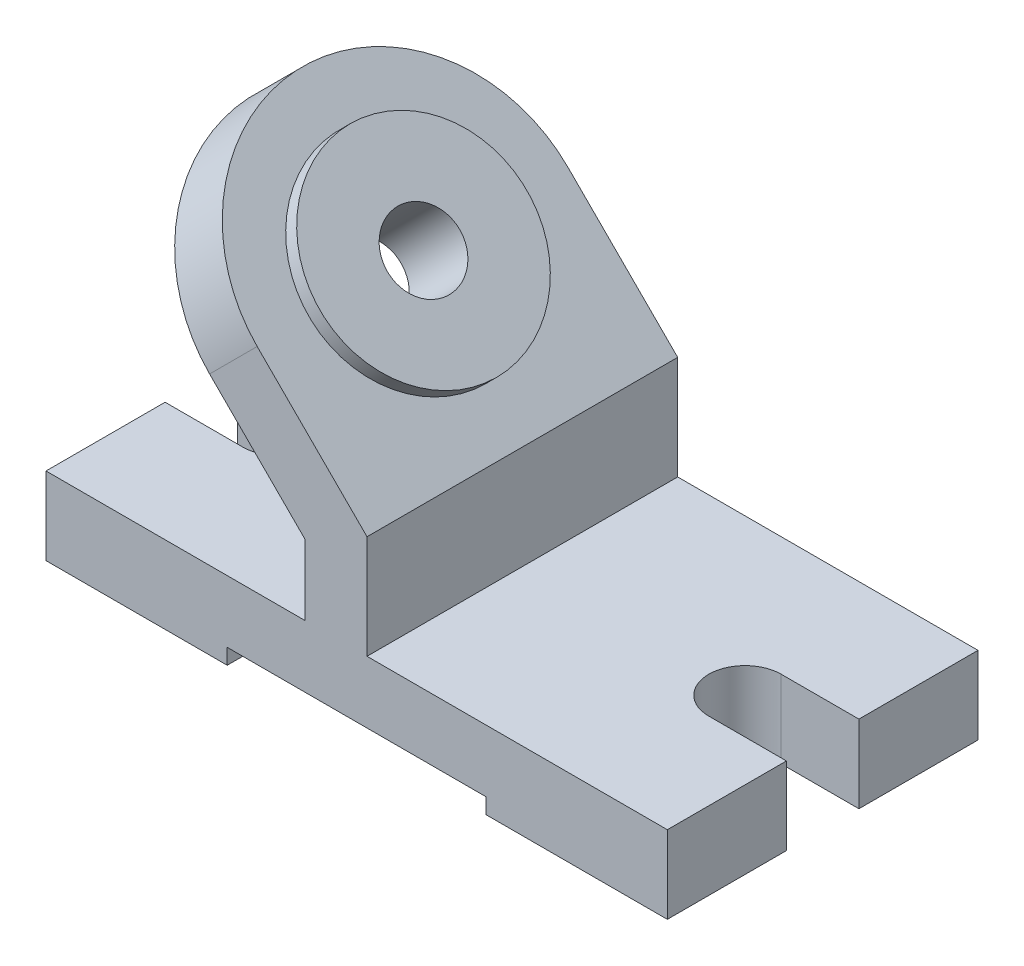
from build123d import *

# Parameters (mm, degrees)
EXTRUDE_1_DEPTH     = 30
CUT_EXTRUDE_1_DEPTH = 69.738635424
EXTRUDE_2_DEPTH     = 30
SKETCH_4_R          = 30
EXTRUDE_3_DEPTH     = 13
EXTRUDE_4_DEPTH     = 3
CUT_EXTRUDE_2_REACH = 102.632
SKETCH_5_R          = 7
RIB_1_REACH         = 102.196
SKETCH_6_WALL_W     = 230.660820914
SKETCH_6_WALL_H     = 10


with BuildPart() as part:
    # 草图1 → 凸台-拉伸1 (new, symmetric)
    with BuildSketch(Plane.XY):
        Polygon((-25, 0), (-25, -3), (-60, -3), (-60, 12), (60, 12), (60, -3), (25, -3), (25, 0), align=None)
    extrude(amount=EXTRUDE_1_DEPTH, both=True)

    # 草图2 → 切除-拉伸1 (cut, through all)
    with BuildSketch(Plane(origin=(0, 12, 0), x_dir=(1, 0, 0), z_dir=(0, 1, 0))):
        with BuildLine():
            Line((75, -7), (45, -7))
            ThreePointArc((45, -7), (38, 0), (45, 7))
            Line((45, 7), (75, 7))
            ThreePointArc((75, 7), (82, 0), (75, -7))
        make_face()
        with BuildLine():
            Line((-75, -7), (-45, -7))
            ThreePointArc((-45, -7), (-38, 0), (-45, 7))
            Line((-45, 7), (-75, 7))
            ThreePointArc((-75, 7), (-82, 0), (-75, -7))
        make_face()
    extrude(amount=-CUT_EXTRUDE_1_DEPTH, mode=Mode.SUBTRACT)

    # 草图3 → 凸台-拉伸2 (add, symmetric)
    with BuildSketch(Plane.XY):
        Polygon((-10, 12), (2, 12), (2, 32), (-19.213203436, 53.213203436), (-28.405591591, 44.02081528), (-10, 25.615223689), align=None)
    extrude(amount=EXTRUDE_2_DEPTH, both=True)

    # 草图4 → 凸台-拉伸3 (add)
    with BuildSketch(Plane(origin=(17, 17, 0), x_dir=(0, 0, -1), z_dir=(0.7071067811865483, 0.7071067811865468, 0))):
        with Locations((0, 51.213203436)):
            Circle(SKETCH_4_R)
    extrude(amount=-EXTRUDE_3_DEPTH)

    # 草图4<3> → 凸台-拉伸4 (add)
    with BuildSketch(Plane(origin=(17, 17, 0), x_dir=(0, 0, -1), z_dir=(0.7071067811865483, 0.7071067811865468, 0))):
        with BuildLine():
            Line((7, 51.213203436), (20, 51.213203436))
            ThreePointArc((20, 51.213203436), (0, 71.213203436), (-20, 51.213203436))
            Line((-20, 51.213203436), (-7, 51.213203436))
            ThreePointArc((-7, 51.213203436), (0, 58.213203436), (7, 51.213203436))
        make_face()
        with BuildLine():
            ThreePointArc((-20, 51.213203436), (0, 31.213203436), (20, 51.213203436))
            Line((20, 51.213203436), (7, 51.213203436))
            ThreePointArc((7, 51.213203436), (0, 44.213203436), (-7, 51.213203436))
            Line((-7, 51.213203436), (-20, 51.213203436))
        make_face()
    extrude(amount=EXTRUDE_4_DEPTH)

    # 草图5 → 切除-拉伸2 (cut, up to next)
    with BuildSketch(Plane(origin=(17, 17, 0), x_dir=(0, 0, -1), z_dir=(0.7071067811865483, 0.7071067811865468, 0)), mode=Mode.PRIVATE) as cut_extrude_2_sk1:
        with Locations(Location((0, 51.213203436, 0), (0, 0, 90))):
            Circle(SKETCH_5_R)
    cut_extrude_2_tool1 = extrude(cut_extrude_2_sk1.sketch, amount=-CUT_EXTRUDE_2_REACH, mode=Mode.PRIVATE) & part.part
    add(cut_extrude_2_tool1.solids().sort_by_distance((-19.213203, 53.213203, 0))[0], mode=Mode.SUBTRACT)

    # 草图6 wall → 筋1 (add, up to next)
    with BuildSketch(Plane(origin=(-27.932923579, 24.240535423, 0), x_dir=(-0.5, -0.866025403784, 0), z_dir=(0.866025403784, -0.5, 0)), mode=Mode.PRIVATE) as rib_1_sk1:
        Rectangle(SKETCH_6_WALL_W, SKETCH_6_WALL_H)
    rib_1_tool1 = extrude(rib_1_sk1.sketch, amount=RIB_1_REACH, mode=Mode.PRIVATE) - part.part
    add(rib_1_tool1.solids().sort_by_distance((-27.932923579, 24.240535423, 0))[0])


solid = part.part
